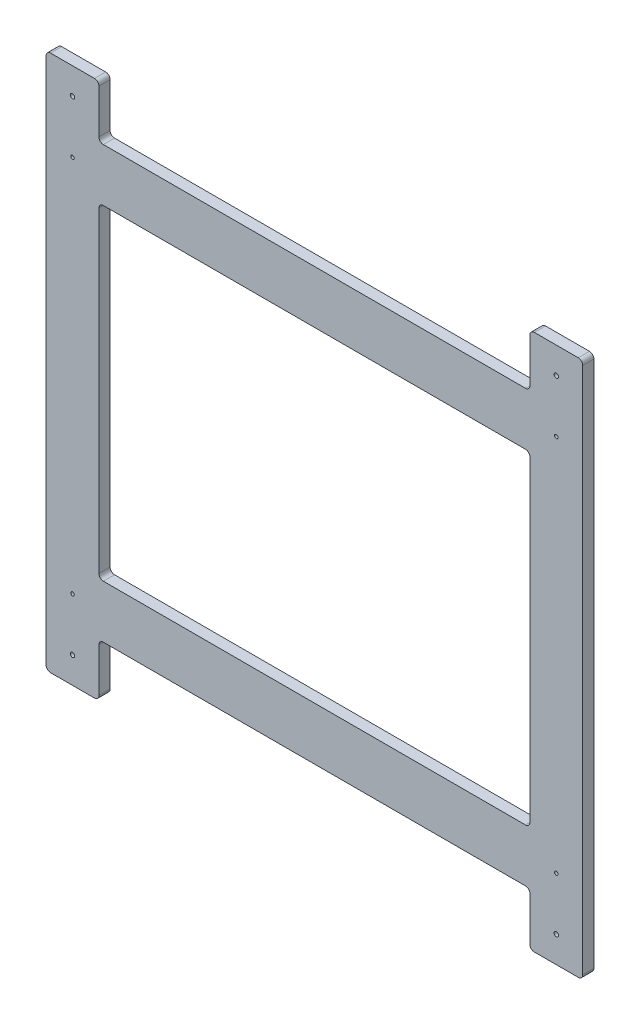
from build123d import *

# Parameters (mm, degrees)
BOSS_EXTRUDE1_DEPTH  = 6.35
M3_CLEARANCE_HOLE3_D = 2
M3_CLEARANCE_HOLE2_D = 2.5


with BuildPart() as part:
    # Sketch7 → Boss-Extrude1 (new body)
    with BuildSketch(Plane.XY):
        with BuildLine():
            Line((-119.9, -122.4), (119.9, -122.4))
            ThreePointArc((119.9, -122.4), (121.667766953, -123.132233047), (122.4, -124.9))
            Line((122.4, -124.9), (122.4, -149.9))
            ThreePointArc((122.4, -149.9), (123.132233047, -151.667766953), (124.9, -152.4))
            Line((124.9, -152.4), (149.9, -152.4))
            ThreePointArc((149.9, -152.4), (151.667766953, -151.667766953), (152.4, -149.9))
            Line((152.4, -149.9), (152.4, -102.186961883))
            Line((152.4, -102.186961883), (152.4, 120.74319893))
            Line((152.4, 120.74319893), (152.4, 149.9))
            ThreePointArc((152.4, 149.9), (151.667766953, 151.667766953), (149.9, 152.4))
            Line((149.9, 152.4), (124.9, 152.4))
            ThreePointArc((124.9, 152.4), (123.132233047, 151.667766953), (122.4, 149.9))
            Line((122.4, 149.9), (122.4, 124.9))
            ThreePointArc((122.4, 124.9), (121.667766953, 123.132233047), (119.9, 122.4))
            Line((119.9, 122.4), (-119.9, 122.4))
            ThreePointArc((-119.9, 122.4), (-121.667766953, 123.132233047), (-122.4, 124.9))
            Line((-122.4, 124.9), (-122.4, 149.9))
            ThreePointArc((-122.4, 149.9), (-123.132233047, 151.667766953), (-124.9, 152.4))
            Line((-124.9, 152.4), (-149.9, 152.4))
            ThreePointArc((-149.9, 152.4), (-151.667766953, 151.667766953), (-152.4, 149.9))
            Line((-152.4, 149.9), (-152.4, 102.186961883))
            Line((-152.4, 102.186961883), (-152.4, -120.74319893))
            Line((-152.4, -120.74319893), (-152.4, -149.9))
            ThreePointArc((-152.4, -149.9), (-151.667766953, -151.667766953), (-149.9, -152.4))
            Line((-149.9, -152.4), (-124.9, -152.4))
            ThreePointArc((-124.9, -152.4), (-123.132233047, -151.667766953), (-122.4, -149.9))
            Line((-122.4, -149.9), (-122.4, -124.9))
            ThreePointArc((-122.4, -124.9), (-121.667766953, -123.132233047), (-119.9, -122.4))
        make_face()
        with BuildLine():
            Line((-119.9, -92.4), (119.9, -92.4))
            ThreePointArc((119.9, -92.4), (121.667766953, -91.667766953), (122.4, -89.9))
            Line((122.4, -89.9), (122.4, 89.9))
            ThreePointArc((122.4, 89.9), (121.667766953, 91.667766953), (119.9, 92.4))
            Line((119.9, 92.4), (-119.9, 92.4))
            ThreePointArc((-119.9, 92.4), (-121.667766953, 91.667766953), (-122.4, 89.9))
            Line((-122.4, 89.9), (-122.4, -89.9))
            ThreePointArc((-122.4, -89.9), (-121.667766953, -91.667766953), (-119.9, -92.4))
        make_face(mode=Mode.SUBTRACT)
    extrude(amount=BOSS_EXTRUDE1_DEPTH)

    # M3 Clearance Hole3 (through all)
    with Locations(Plane.XY.offset(6.35)):
        with Locations((-137.4, 107.4), (-137.4, -107.4), (137.4, -107.4), (137.4, 107.4)):
            Hole(M3_CLEARANCE_HOLE3_D / 2)

    # M3 Clearance Hole2 (through all)
    with Locations(Plane.XY.offset(6.35)):
        with Locations((-137.4, 137.4), (137.4, 137.4), (137.4, -137.4), (-137.4, -137.4)):
            Hole(M3_CLEARANCE_HOLE2_D / 2)


solid = part.part
